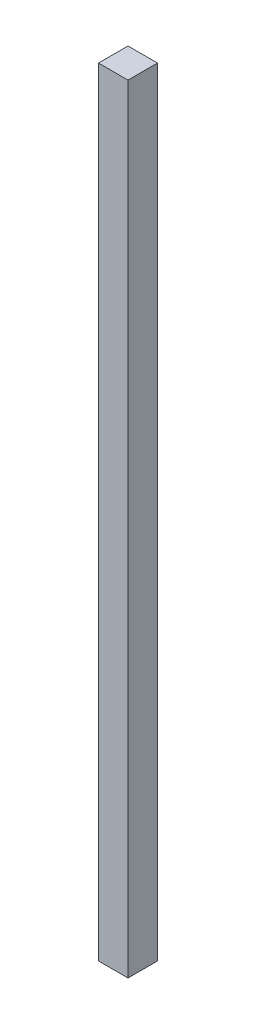
from build123d import *

# Parameters (mm, degrees)
SKETCH1_W           = 18.97366596
SKETCH1_H           = 18.97366596
BOSS_EXTRUDE1_DEPTH = 500


with BuildPart() as part:
    # Sketch1 → Boss-Extrude1 (new body)
    with BuildSketch(Plane(origin=(0, 0, 0), x_dir=(1, 0, 0), z_dir=(0, 1, 0))):
        Rectangle(SKETCH1_W, SKETCH1_H)
    extrude(amount=BOSS_EXTRUDE1_DEPTH)


solid = part.part
